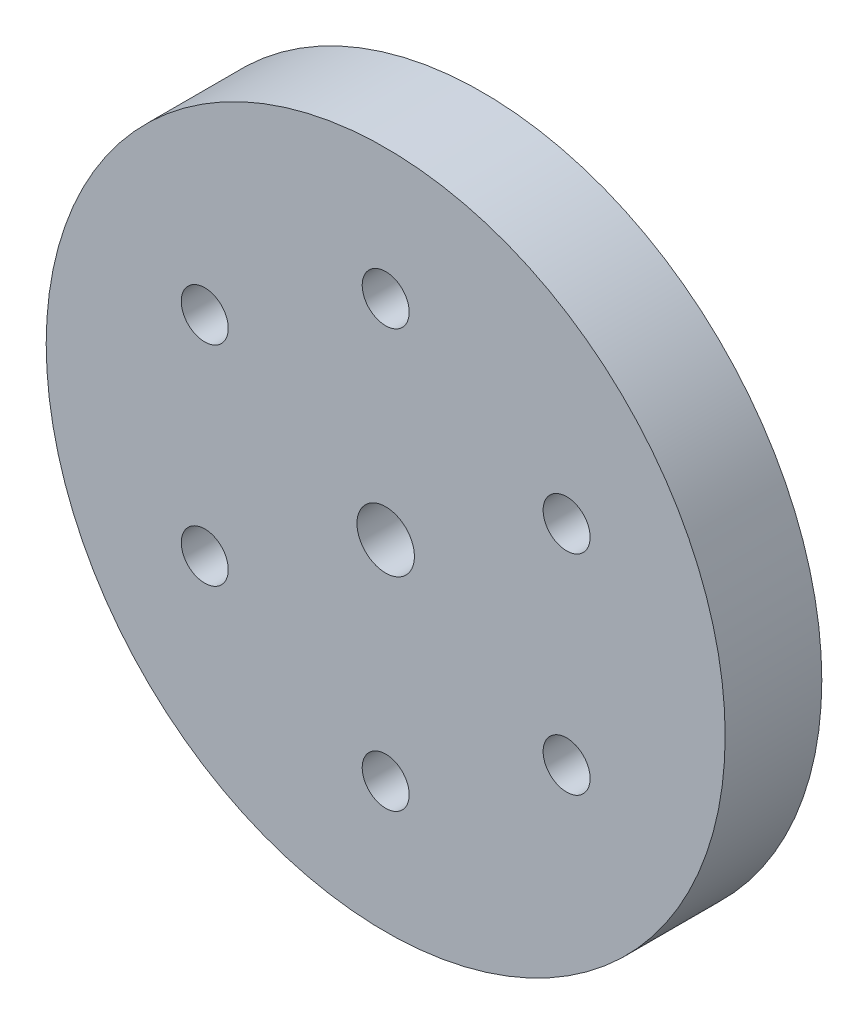
from build123d import *

# Parameters (mm, degrees)
SKETCH_1_R               = 13
EXTRUDE_1_DEPTH          = 3.7
SKETCH_2_R               = 0.9
CUT_EXTRUDE_1_DEPTH      = 19.753399692
SKETCH_2_3_R             = 1.5
CUT_EXTRUDE_2_DEPTH      = 1.5
PATTERN_CIRCULAR_1_COUNT = 6
SKETCH_3_R               = 1.1
CUT_EXTRUDE_3_DEPTH      = 19.753399692


with BuildPart() as part:
    # 草图1 → 凸台-拉伸1 (new body)
    with BuildSketch(Plane.XY):
        Circle(SKETCH_1_R)
    extrude(amount=EXTRUDE_1_DEPTH)

    # 草图2 → 切除-拉伸1 (cut, through all)
    with BuildSketch(Plane(origin=(0, 0, 0), x_dir=(-1, 0, 0), z_dir=(0, 0, -1))):
        with Locations((0, 8)):
            Circle(SKETCH_2_R)
    cut_extrude_1 = extrude(amount=-CUT_EXTRUDE_1_DEPTH, mode=Mode.SUBTRACT)

    # 草图2<3> → 切除-拉伸2 (cut)
    with BuildSketch(Plane(origin=(0, 0, 0), x_dir=(-1, 0, 0), z_dir=(0, 0, -1))):
        with Locations((0, 8)):
            Circle(SKETCH_2_3_R)
    cut_extrude_2 = extrude(amount=-CUT_EXTRUDE_2_DEPTH, mode=Mode.SUBTRACT)

    # 阵列(圆周)1: 切除-拉伸1, 切除-拉伸2 ×6 about axis
    pattern_circular_1_axis = Axis((0, 0, 3.7), (0, 0, -1))
    add([cut_extrude_1.rotate(pattern_circular_1_axis, i * 360 / PATTERN_CIRCULAR_1_COUNT) for i in range(1, PATTERN_CIRCULAR_1_COUNT)], mode=Mode.SUBTRACT)
    add([cut_extrude_2.rotate(pattern_circular_1_axis, i * 360 / PATTERN_CIRCULAR_1_COUNT) for i in range(1, PATTERN_CIRCULAR_1_COUNT)], mode=Mode.SUBTRACT)

    # 草图3 → 切除-拉伸3 (cut, through all)
    with BuildSketch(Plane(origin=(0, 0, 0), x_dir=(-1, 0, 0), z_dir=(0, 0, -1))):
        Circle(SKETCH_3_R)
    extrude(amount=-CUT_EXTRUDE_3_DEPTH, mode=Mode.SUBTRACT)


solid = part.part
